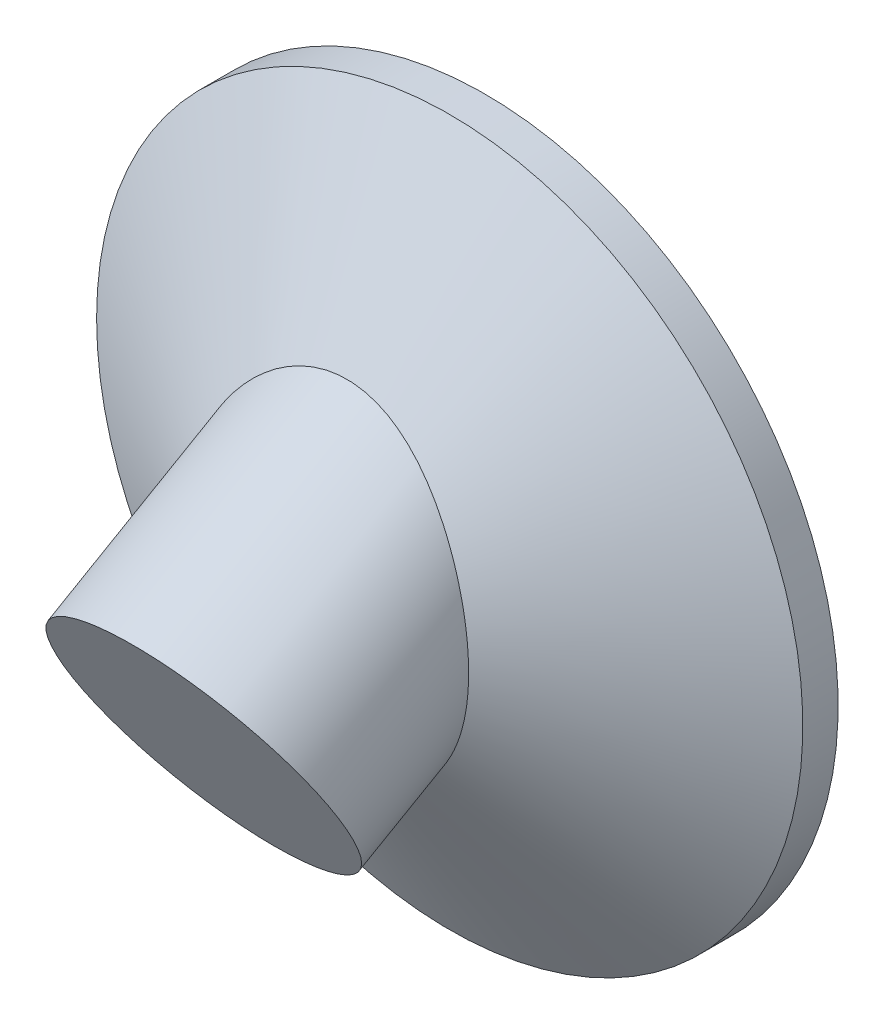
from build123d import *

# Parameters (mm, degrees)
BOSS_EXTRUDE1_REACH = 1997.161
SKETCH3_R           = 400


with BuildPart() as part:
    # Sketch2 → Revolve-Thin1 (revolve)
    with BuildSketch(Plane(origin=(0, 0, 0), x_dir=(1, 0, 0), z_dir=(0, 1, 0))):
        Polygon((0, -400), (-393.782217351, -400), (-1000, -50), (-1000, 50), (-393.782217351, 400), (0, 400), (0, 390), (-391.102725427, 390), (-990, 44.226497308), (-990, -44.226497308), (-391.102725427, -390), (0, -390), align=None)
    revolve(axis=Axis((0, 0, -819.038383134), (0, 0, 1)))

    # Boss-Extrude1: up to this cone (the profile starts outside it)
    boss_extrude1_end = Plane(origin=(0, 0, 746.410162), z_dir=(0, 0, -1)).offset(119.05989381) * Cone(1.732e-06, 3253.832564808, 1878.60110619, align=(Align.CENTER, Align.CENTER, Align.MIN), mode=Mode.PRIVATE)
    # Sketch3 → Boss-Extrude1 (add, up to the surface)
    with BuildSketch(Plane(origin=(0, -373.205080757, 646.410161514), x_dir=(1, 0, 0), z_dir=(0, -0.500000000000001, 0.866025403784438)), mode=Mode.PRIVATE) as boss_extrude1_sk1:
        with Locations(Location((0, 200, 0), (0, 0, 270))):
            Circle(SKETCH3_R)
    boss_extrude1_tool1 = extrude(boss_extrude1_sk1.sketch, amount=-BOSS_EXTRUDE1_REACH, mode=Mode.PRIVATE) - boss_extrude1_end
    add(boss_extrude1_tool1.solids().sort_by_distance((0, -200, 746.410162))[0])


solid = part.part
